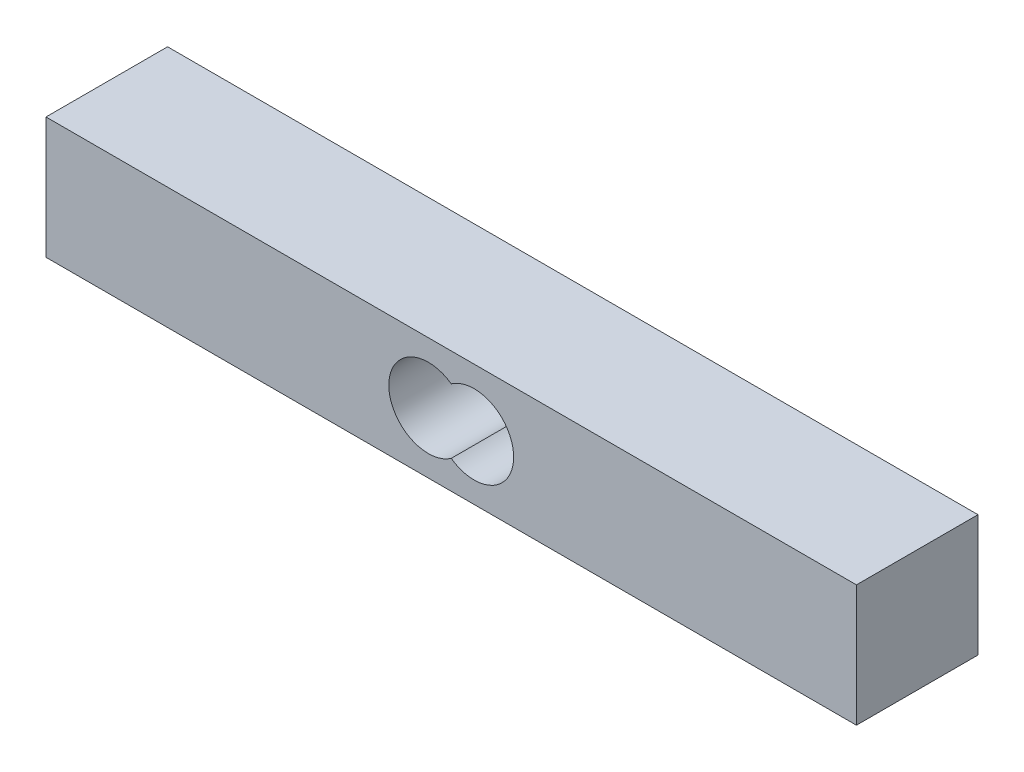
from build123d import *

# Parameters (mm, degrees)
CROQUIS1_W              = 80
CROQUIS1_H              = 12
SALIENTE_EXTRUIR1_DEPTH = 12
CORTAR_EXTRUIR1_DEPTH   = 12


with BuildPart() as part:
    # Croquis1 → Saliente-Extruir1 (new body)
    with BuildSketch(Plane(origin=(0, 0, 0), x_dir=(1, 0, 0), z_dir=(0, 1, 0))):
        with Locations((40, 6)):
            Rectangle(CROQUIS1_W, CROQUIS1_H)
    extrude(amount=SALIENTE_EXTRUIR1_DEPTH)

    # Croquis2 → Cortar-Extruir1 (cut)
    with BuildSketch(Plane.XY):
        with BuildLine():
            ThreePointArc((40, 2.81412174), (46.163496931, 6), (40, 9.18587826))
            ThreePointArc((40, 9.18587826), (33.836503069, 6), (40, 2.81412174))
        make_face()
    extrude(amount=-CORTAR_EXTRUIR1_DEPTH, mode=Mode.SUBTRACT)


solid = part.part
